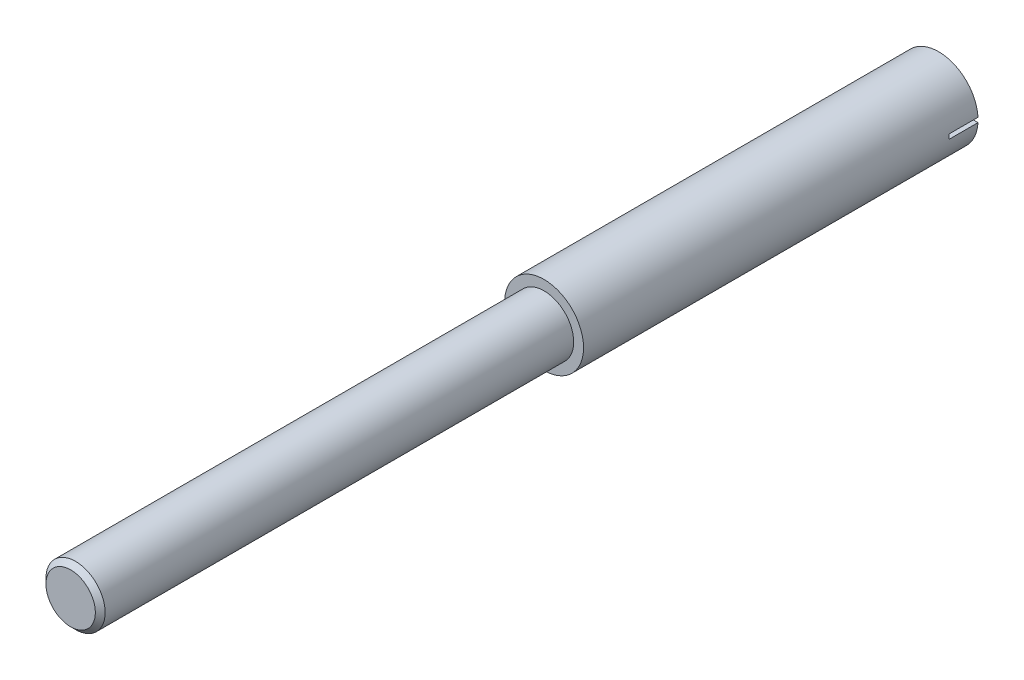
from build123d import *

# Parameters (mm, degrees)
SKETCH1_R               = 0.5
BOSS_EXTRUDE1_DEPTH     = 5
SKETCH1_3_R             = 0.375
BOSS_EXTRUDE2_DEPTH     = 11
CHAMFER1_SIZE           = 0.062
CUT_EXTRUDE1_DEPTH      = 12.022703843
CUT_EXTRUDE1_DEPTH_BACK = 12.022703843
SKETCH2_W               = 0.74
SKETCH2_H               = 0.05859


with BuildPart() as part:
    # Sketch1 → Boss-Extrude1 (new body)
    with BuildSketch(Plane.XY):
        Circle(SKETCH1_R)
    extrude(amount=BOSS_EXTRUDE1_DEPTH)

    # Sketch1<3> → Boss-Extrude2 (add)
    with BuildSketch(Plane.XY):
        Circle(SKETCH1_3_R)
    extrude(amount=BOSS_EXTRUDE2_DEPTH)

    # Chamfer1
    chamfer1_edges = [part.edges().sort_by_distance(p)[0] for p in [
        (-0.375, 0, 11),
    ]]
    chamfer(chamfer1_edges, length=CHAMFER1_SIZE)

    # Sketch2 → Cut-Extrude1 (cut, two sides: drawn at the far end of the back side and taken through both)
    with BuildSketch(Plane(origin=(0, 0, 0), x_dir=(0, 0, -1), z_dir=(1, 0, 0)).offset(-CUT_EXTRUDE1_DEPTH_BACK)):
        Rectangle(SKETCH2_W, SKETCH2_H)
    extrude(amount=CUT_EXTRUDE1_DEPTH + CUT_EXTRUDE1_DEPTH_BACK, mode=Mode.SUBTRACT)


solid = part.part
